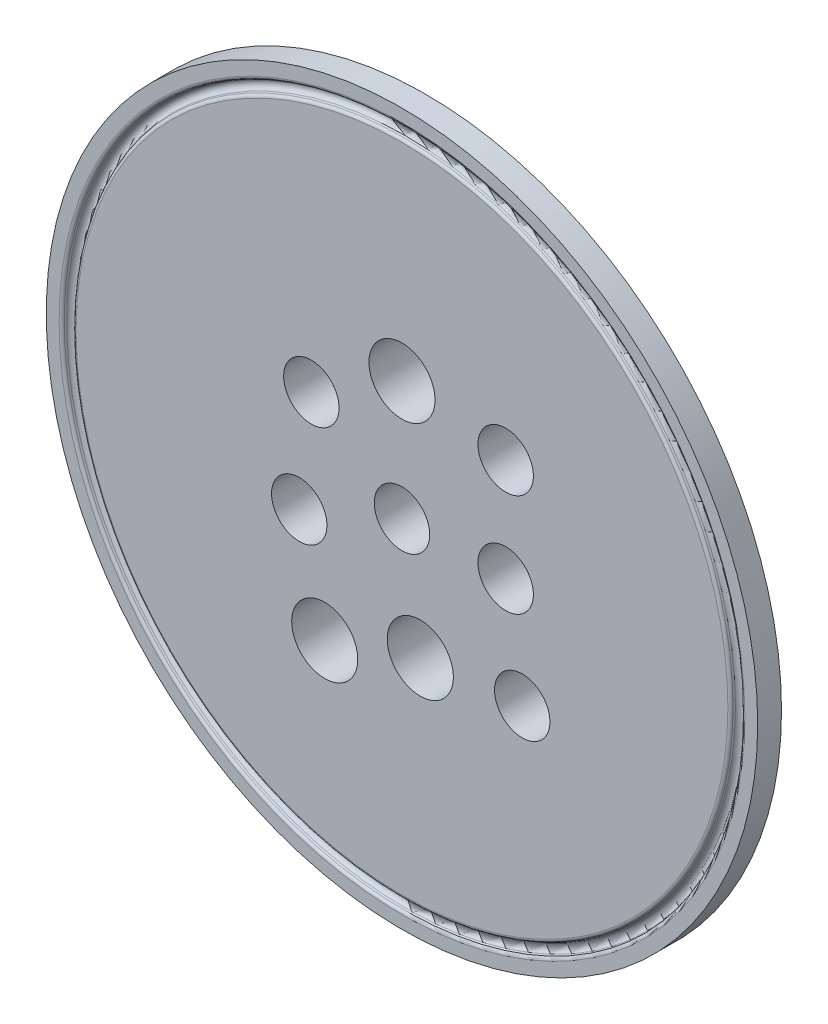
from build123d import *

# Parameters (mm, degrees)
SKETCH2_R          = 6.5
SKETCH2_R_2        = 7.75
CUT_EXTRUDE1_DEPTH = 119.521470637


with BuildPart() as part:
    # Sketch1 → Revolve1 (revolve)
    with BuildSketch(Plane(origin=(0, 0, 0), x_dir=(0, 0, -1), z_dir=(1, 0, 0)), mode=Mode.PRIVATE) as revolve1_sk:
        with BuildLine():
            Line((0, 0), (0, 76.444627725))
            ThreePointArc((0, 76.444627725), (0.130798304, 76.879222907), (0.479738309, 77.169433247))
            Line((0.479738309, 77.169433247), (0.872854821, 77.336301306))
            ThreePointArc((0.872854821, 77.336301306), (1.6002, 78.4352), (0.872854821, 79.534098694))
            Line((0.872854821, 79.534098694), (0.479738309, 79.700966753))
            ThreePointArc((0.479738309, 79.700966753), (0.130798304, 79.991177093), (0, 80.425772275))
            Line((0, 80.425772275), (0, 83.439))
            Line((0, 83.439), (5.588, 83.439))
            Line((5.588, 83.439), (11.0998, 68.295453959))
            Line((11.0998, 68.295453959), (11.0998, 0))
            Line((11.0998, 0), (0, 0))
        make_face()
    revolve(revolve1_sk.sketch.rotate(Axis((0, 0, 0), (0, 0, -1)), 90), axis=Axis((0, 0, 0), (0, 0, -1)))

    # Sketch2 → Cut-Extrude1 (cut, through all)
    with BuildSketch(Plane(origin=(0, 0, -11.0998), x_dir=(-1, 0, 0), z_dir=(0, 0, -1))):
        Circle(SKETCH2_R)
        with Locations((0, 27.9765569)):
            Circle(SKETCH2_R_2)
        with Locations((-24.324092368, 0)):
            Circle(SKETCH2_R)
        with Locations((24.098999837, -10.15759269)):
            Circle(SKETCH2_R)
        with Locations((-24.324092368, 24.067370628)):
            Circle(SKETCH2_R)
        with Locations((21.259374059, 15.100131331)):
            Circle(SKETCH2_R)
        with Locations((-4.297257938, -26.149169437)):
            Circle(SKETCH2_R_2)
        with Locations((-28.209896064, -23.907359612)):
            Circle(SKETCH2_R)
        with Locations((18.120840305, -33.771322839)):
            Circle(SKETCH2_R_2)
    extrude(amount=-CUT_EXTRUDE1_DEPTH, mode=Mode.SUBTRACT)


solid = part.part
